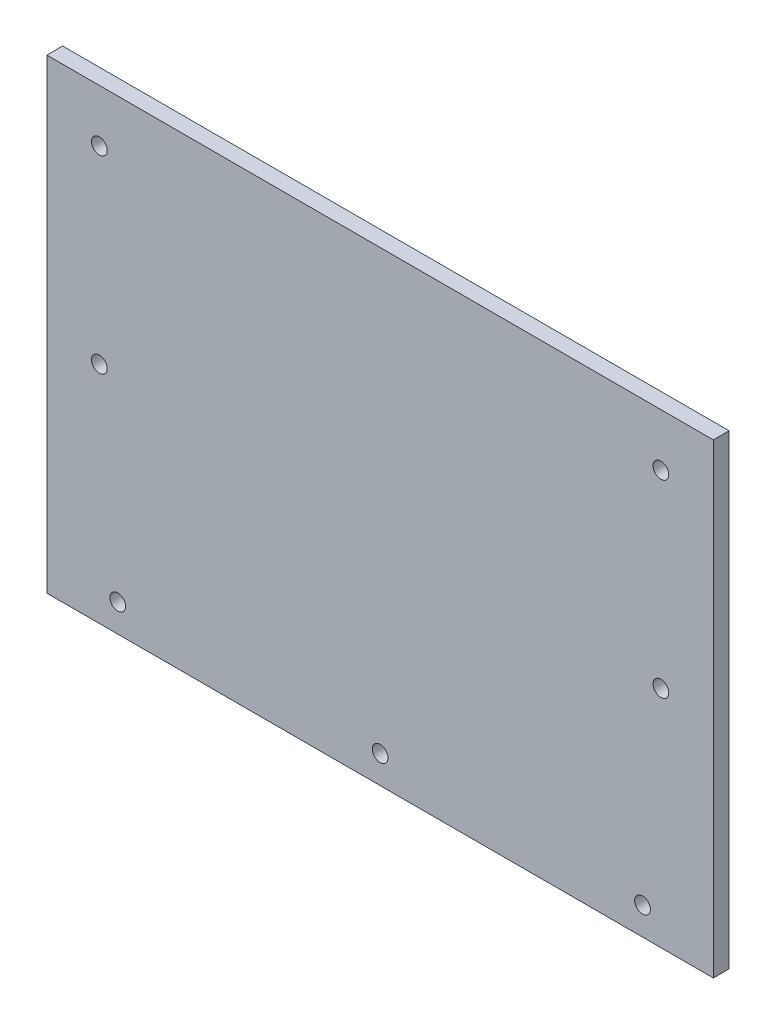
from build123d import *

# Parameters (mm, degrees)
SKETCH_1_W          = 127
SKETCH_1_H          = 92
EXTRUDE_1_DEPTH     = 3
SKETCH_2_R          = 1.5
CUT_EXTRUDE_1_DEPTH = 79.468146403
SKETCH_3_R          = 1.5
CUT_EXTRUDE_2_DEPTH = 79.468146403
SKETCH_4_W          = 127
SKETCH_4_H          = 3.2
CUT_EXTRUDE_3_DEPTH = 10


with BuildPart() as part:
    # 草图1 → 凸台-拉伸1 (new body)
    with BuildSketch(Plane.XY):
        Rectangle(SKETCH_1_W, SKETCH_1_H)
    extrude(amount=EXTRUDE_1_DEPTH)

    # 草图2 → 切除-拉伸1 (cut, through all)
    with BuildSketch(Plane.XY.offset(3)):
        with Locations((0, -37.5)):
            Circle(SKETCH_2_R)
        with Locations((50, -37.5)):
            Circle(SKETCH_2_R)
        with Locations((-50, -37.5)):
            Circle(SKETCH_2_R)
    extrude(amount=-CUT_EXTRUDE_1_DEPTH, mode=Mode.SUBTRACT)

    # 草图3 → 切除-拉伸2 (cut, through all)
    with BuildSketch(Plane.XY.offset(3)):
        with Locations((-53.5, 36)):
            Circle(SKETCH_3_R)
        with Locations((53.5, 36)):
            Circle(SKETCH_3_R)
        with Locations((-53.5, 0)):
            Circle(SKETCH_3_R)
        with Locations((53.5, 0)):
            Circle(SKETCH_3_R)
    extrude(amount=-CUT_EXTRUDE_2_DEPTH, mode=Mode.SUBTRACT)

    # 草图4 → 切除-拉伸3 (cut)
    with BuildSketch(Plane(origin=(0, 0, 0), x_dir=(-1, 0, 0), z_dir=(0, 0, -1))):
        with Locations((0, -44.4)):
            Rectangle(SKETCH_4_W, SKETCH_4_H)
    extrude(amount=-CUT_EXTRUDE_3_DEPTH, mode=Mode.SUBTRACT)


solid = part.part
